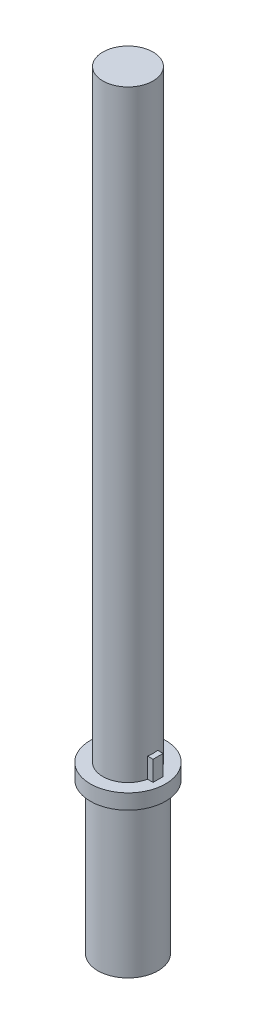
from build123d import *

# Parameters (mm, degrees)
SKETCH_1_R      = 6
SKETCH_1_R_2    = 5.25
EXTRUDE_2_DEPTH = 30
SKETCH_2_R      = 7.5
EXTRUDE_3_DEPTH = 3
SKETCH_3_R      = 5
EXTRUDE_4_DEPTH = 120
EXTRUDE_6_DEPTH = 4


with BuildPart() as part:
    # 草图1 → 凸台-拉伸2 (new body)
    with BuildSketch(Plane(origin=(0, 0, 0), x_dir=(1, 0, 0), z_dir=(0, 1, 0))):
        with Locations(Location((0, 0, 0), (0, 0, 270))):
            Circle(SKETCH_1_R)
        with Locations(Location((0, 0, 0), (0, 0, 270))):
            Circle(SKETCH_1_R_2, mode=Mode.SUBTRACT)
    extrude(amount=EXTRUDE_2_DEPTH)

    # 草图2 → 凸台-拉伸3 (add)
    with BuildSketch(Plane(origin=(0, 30, 0), x_dir=(1, 0, 0), z_dir=(0, 1, 0))):
        with Locations(Location((0, 0, 0), (0, 0, 270))):
            Circle(SKETCH_2_R)
    extrude(amount=EXTRUDE_3_DEPTH)

    # 草图3 → 凸台-拉伸4 (add)
    with BuildSketch(Plane(origin=(0, 33, 0), x_dir=(1, 0, 0), z_dir=(0, 1, 0))):
        with Locations(Location((0, 0, 0), (0, 0, 270))):
            Circle(SKETCH_3_R)
    extrude(amount=EXTRUDE_4_DEPTH)

    # 草图4 → 凸台-拉伸6 (add)
    with BuildSketch(Plane(origin=(0, 33, 0), x_dir=(1, 0, 0), z_dir=(0, 1, 0))):
        with BuildLine():
            Line((6, 1), (4.898979486, 1))
            ThreePointArc((4.898979486, 1), (4.974680765, 0.50254481), (5, 0))
            Line((5, 0), (6, 0))
            Line((6, 0), (6, 1))
        make_face()
        with BuildLine():
            ThreePointArc((5, 0), (4.974680765, -0.50254481), (4.898979486, -1))
            Line((4.898979486, -1), (6, -1))
            Line((6, -1), (6, 0))
            Line((6, 0), (5, 0))
        make_face()
    extrude(amount=EXTRUDE_6_DEPTH)


solid = part.part
